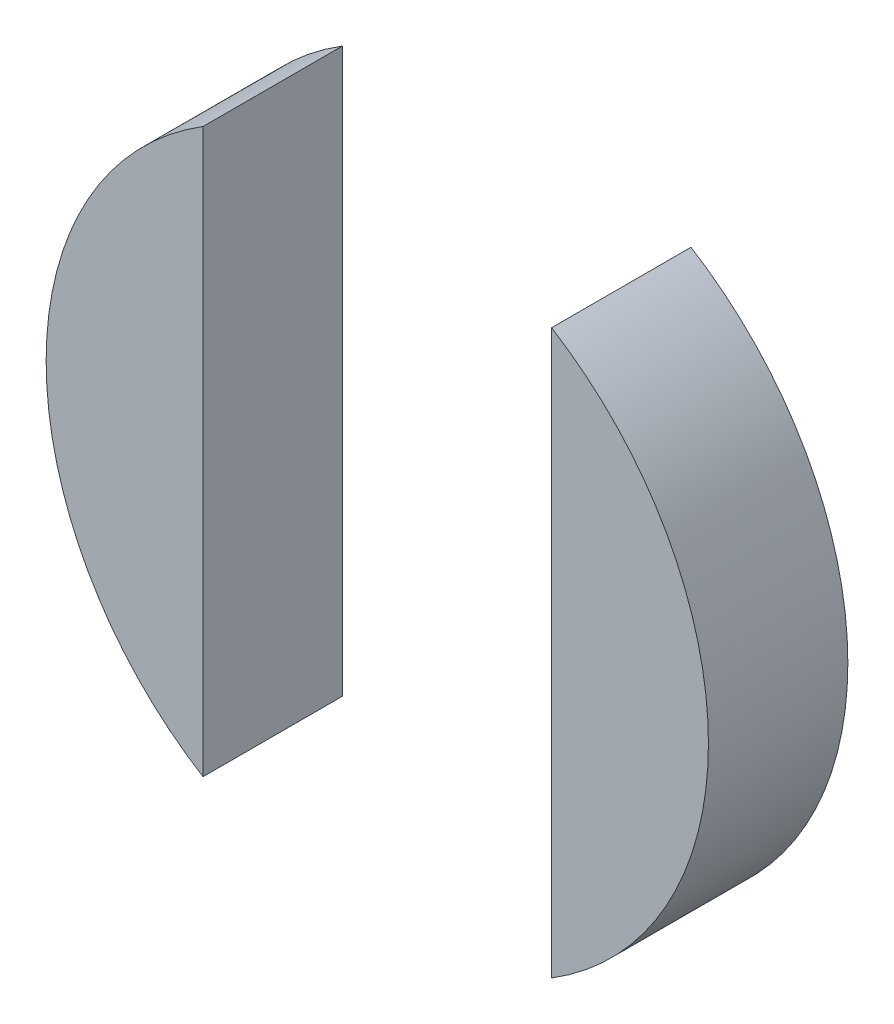
from build123d import *

# Parameters (mm, degrees)
BOSS_EXTRUDE1_DEPTH   = 4
BOSS_EXTRUDE1_2_DEPTH = 4


with BuildPart() as part:
    # Sketch1 → Boss-Extrude1 (new body)
    with BuildSketch(Plane.XY):
        with BuildLine():
            Line((-5, 8.077747211), (-5, -8.077747211))
            ThreePointArc((-5, -8.077747211), (-9.5, 0), (-5, 8.077747211))
        make_face()
    extrude(amount=BOSS_EXTRUDE1_DEPTH)


with BuildPart() as body_2:
    # Sketch1 → Boss-Extrude1 2 (new body)
    with BuildSketch(Plane.XY):
        with BuildLine():
            Line((5, 8.077747211), (5, -8.077747211))
            ThreePointArc((5, -8.077747211), (9.5, 0), (5, 8.077747211))
        make_face()
    extrude(amount=BOSS_EXTRUDE1_2_DEPTH)


solid = Compound([part.part, body_2.part])
